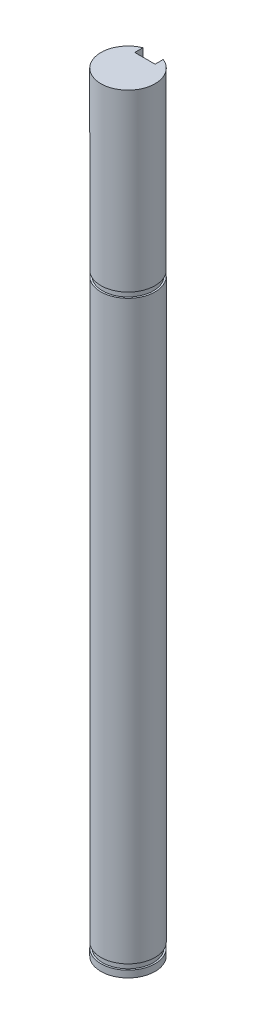
from build123d import *

# Parameters (mm, degrees)
SKETCH1_R           = 4
BOSS_EXTRUDE1_DEPTH = 111
CUT_EXTRUDE1_START  = -0.8
SKETCH2_R           = 4
SKETCH2_R_2         = 3.75
CUT_EXTRUDE1_DEPTH  = 0.8
SKETCH4_R           = 4
BOSS_EXTRUDE3_DEPTH = 0.85
BOSS_EXTRUDE4_START = 0.8
SKETCH3_R           = 3.75
BOSS_EXTRUDE4_DEPTH = 0.8
BOSS_EXTRUDE5_START = 1
SKETCH5_R           = 4
BOSS_EXTRUDE5_DEPTH = 1
SKETCH6_W           = 3
SKETCH6_H           = 3
CUT_EXTRUDE2_DEPTH  = 20


with BuildPart() as part:
    # Sketch1 → Boss-Extrude1 (new body)
    with BuildSketch(Plane(origin=(0, 0, 0), x_dir=(1, 0, 0), z_dir=(0, 1, 0))):
        with Locations(Location((0, 0, 0), (0, 0, 270))):
            Circle(SKETCH1_R)
    extrude(amount=BOSS_EXTRUDE1_DEPTH)

    # Sketch2 → Cut-Extrude1 (cut)
    with BuildSketch(Plane(origin=(0, 86, 0), x_dir=(1, 0, 0), z_dir=(0, 1, 0)).offset(CUT_EXTRUDE1_START)):
        with Locations(Location((0, 0, 0), (0, 0, 270))):
            Circle(SKETCH2_R)
        with Locations(Location((0, 0, 0), (0, 0, 270))):
            Circle(SKETCH2_R_2, mode=Mode.SUBTRACT)
    extrude(amount=CUT_EXTRUDE1_DEPTH, mode=Mode.SUBTRACT)

    # Sketch4 → Boss-Extrude3 (add)
    with BuildSketch(Plane(origin=(0, 111, 0), x_dir=(1, 0, 0), z_dir=(0, 1, 0))):
        with Locations(Location((0, 0, 0), (0, 0, 270))):
            Circle(SKETCH4_R)
    extrude(amount=BOSS_EXTRUDE3_DEPTH)

    # Sketch3 → Boss-Extrude4 (add)
    with BuildSketch(Plane(origin=(0, 0, 0), x_dir=(-1, 0, 0), z_dir=(0, -1, 0)).offset(BOSS_EXTRUDE4_START)):
        with Locations(Location((0, 0, 0), (0, 0, 270))):
            Circle(SKETCH3_R)
    extrude(amount=-BOSS_EXTRUDE4_DEPTH)

    # Sketch5 → Boss-Extrude5 (add)
    with BuildSketch(Plane.XZ.offset(0.8).offset(BOSS_EXTRUDE5_START)):
        with Locations(Location((0, 0, 0), (0, 0, 90))):
            Circle(SKETCH5_R)
    extrude(amount=-BOSS_EXTRUDE5_DEPTH)

    # Sketch6 → Cut-Extrude2 (cut)
    with BuildSketch(Plane(origin=(0, 111.85, 0), x_dir=(1, 0, 0), z_dir=(0, 1, 0))):
        with Locations((0, 4)):
            Rectangle(SKETCH6_W, SKETCH6_H)
    extrude(amount=-CUT_EXTRUDE2_DEPTH, mode=Mode.SUBTRACT)


solid = part.part
